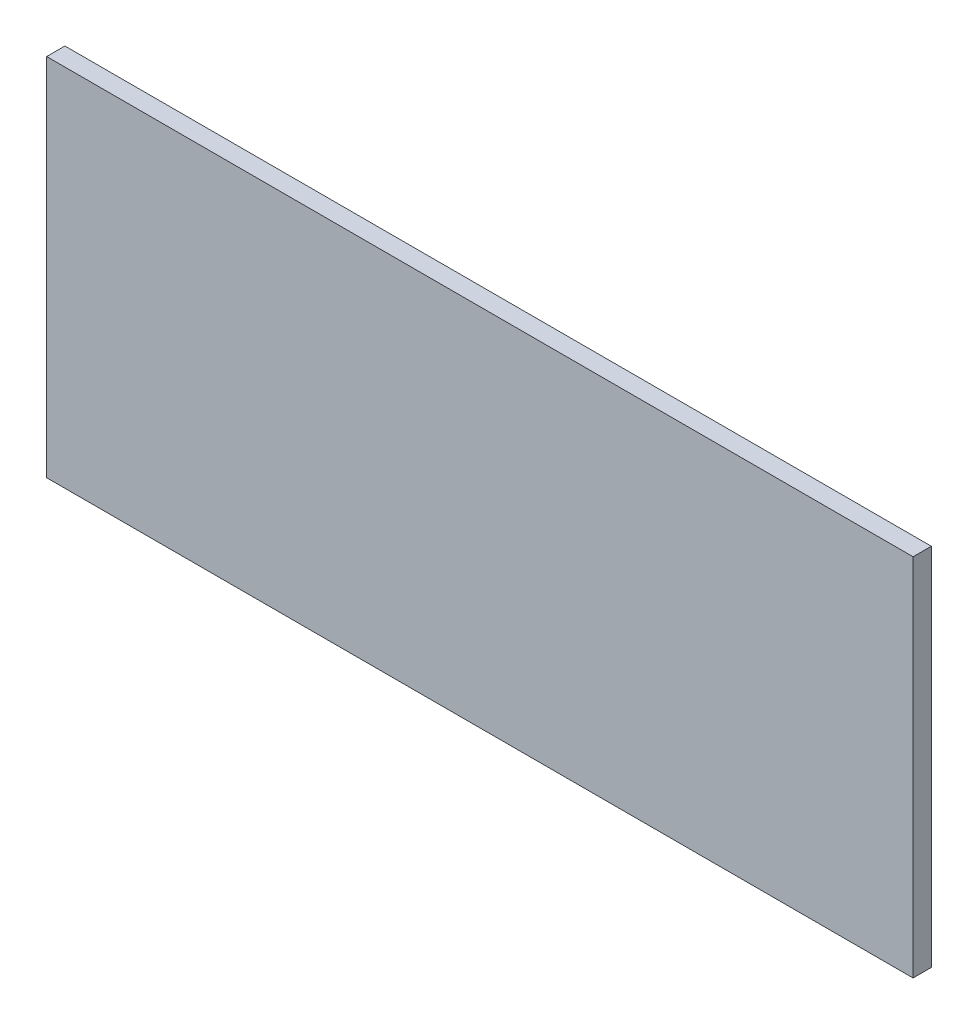
from build123d import *

# Parameters (mm, degrees)
SKETCH1_W           = 190
SKETCH1_H           = 80
BOSS_EXTRUDE1_DEPTH = 4


with BuildPart() as part:
    # Sketch1 → Boss-Extrude1 (new body)
    with BuildSketch(Plane.XY):
        with Locations((3.237268845, -51.70609356)):
            Rectangle(SKETCH1_W, SKETCH1_H)
    extrude(amount=BOSS_EXTRUDE1_DEPTH)


solid = part.part
